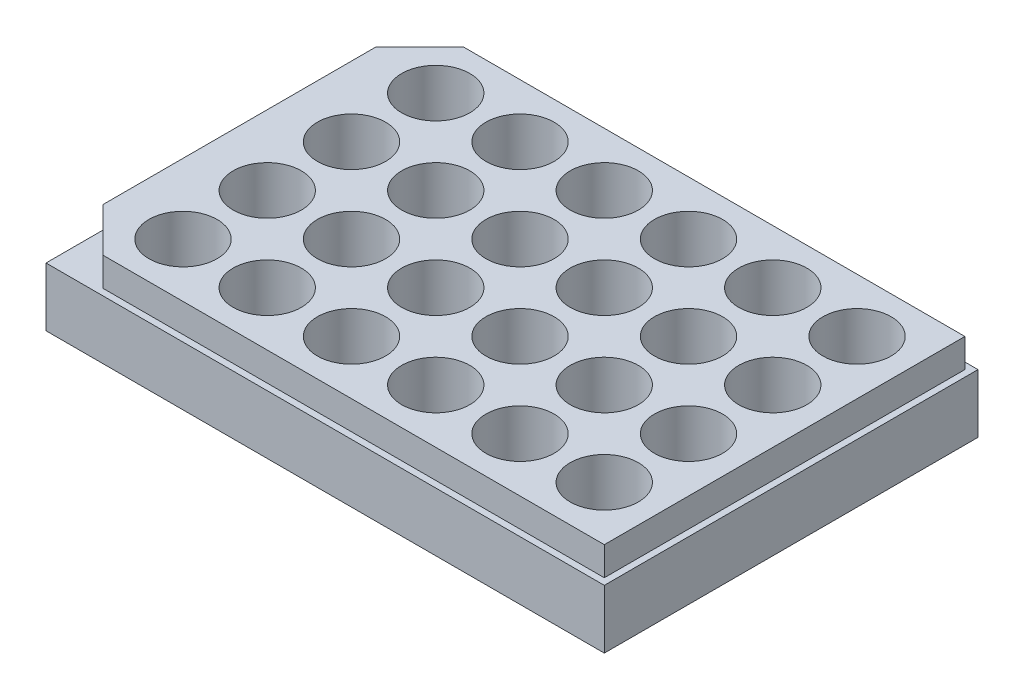
from build123d import *

# Parameters (mm, degrees)
SKETCH1_W         = 127.89
SKETCH1_H         = 85.6
MAIN_PLATE_DEPTH  = 20.02
WELLS_LSP_R       = 7.81
WELLS_DEPTH_DEPTH = 80.508511651
SKETCH7_W         = 127.89
SKETCH7_H         = 85.6
SKETCH7_W_2       = 124.89
SKETCH7_H_2       = 82.6
FLANGE_DEPTH      = 6.57
STYLE_3_DEPTH     = 6.57


with BuildPart() as part:
    # Sketch1 → Main Plate (new body)
    with BuildSketch(Plane(origin=(0, 0, 0), x_dir=(1, 0, 0), z_dir=(0, 1, 0))):
        Rectangle(SKETCH1_W, SKETCH1_H)
    extrude(amount=MAIN_PLATE_DEPTH)

    # Wells_LSP → Wells Depth (cut, through all)
    with BuildSketch(Plane(origin=(0, 20.02, 0), x_dir=(1, 0, 0), z_dir=(0, 1, 0))):
        with Locations(Location((-46.425, 28.96, 0), (0, 0, 270))):
            Circle(WELLS_LSP_R)
        with Locations(Location((-27.125, 28.96, 0), (0, 0, 270))):
            Circle(WELLS_LSP_R)
        with Locations(Location((-7.825, 28.96, 0), (0, 0, 270))):
            Circle(WELLS_LSP_R)
        with Locations(Location((11.475, 28.96, 0), (0, 0, 270))):
            Circle(WELLS_LSP_R)
        with Locations(Location((30.775, 28.96, 0), (0, 0, 270))):
            Circle(WELLS_LSP_R)
        with Locations(Location((50.075, 28.96, 0), (0, 0, 270))):
            Circle(WELLS_LSP_R)
        with Locations(Location((-27.125, 9.66, 0), (0, 0, 270))):
            Circle(WELLS_LSP_R)
        with Locations(Location((-7.825, 9.66, 0), (0, 0, 270))):
            Circle(WELLS_LSP_R)
        with Locations(Location((11.475, 9.66, 0), (0, 0, 270))):
            Circle(WELLS_LSP_R)
        with Locations(Location((30.775, 9.66, 0), (0, 0, 270))):
            Circle(WELLS_LSP_R)
        with Locations(Location((50.075, 9.66, 0), (0, 0, 270))):
            Circle(WELLS_LSP_R)
        with Locations(Location((-27.125, -9.64, 0), (0, 0, 270))):
            Circle(WELLS_LSP_R)
        with Locations(Location((-7.825, -9.64, 0), (0, 0, 270))):
            Circle(WELLS_LSP_R)
        with Locations(Location((11.475, -9.64, 0), (0, 0, 270))):
            Circle(WELLS_LSP_R)
        with Locations(Location((30.775, -9.64, 0), (0, 0, 270))):
            Circle(WELLS_LSP_R)
        with Locations(Location((50.075, -9.64, 0), (0, 0, 270))):
            Circle(WELLS_LSP_R)
        with Locations(Location((-27.125, -28.94, 0), (0, 0, 270))):
            Circle(WELLS_LSP_R)
        with Locations(Location((-7.825, -28.94, 0), (0, 0, 270))):
            Circle(WELLS_LSP_R)
        with Locations(Location((11.475, -28.94, 0), (0, 0, 270))):
            Circle(WELLS_LSP_R)
        with Locations(Location((30.775, -28.94, 0), (0, 0, 270))):
            Circle(WELLS_LSP_R)
        with Locations(Location((50.075, -28.94, 0), (0, 0, 270))):
            Circle(WELLS_LSP_R)
        with Locations(Location((-46.425, 9.66, 0), (0, 0, 270))):
            Circle(WELLS_LSP_R)
        with Locations(Location((-46.425, -9.64, 0), (0, 0, 270))):
            Circle(WELLS_LSP_R)
        with Locations(Location((-46.425, -28.94, 0), (0, 0, 270))):
            Circle(WELLS_LSP_R)
    extrude(amount=-WELLS_DEPTH_DEPTH, mode=Mode.SUBTRACT)

    # Sketch7 → Flange (cut)
    with BuildSketch(Plane(origin=(0, 20.02, 0), x_dir=(1, 0, 0), z_dir=(0, 1, 0))):
        Rectangle(SKETCH7_W, SKETCH7_H)
        Rectangle(SKETCH7_W_2, SKETCH7_H_2, mode=Mode.SUBTRACT)
    extrude(amount=-FLANGE_DEPTH, mode=Mode.SUBTRACT)

    # Style Sketch → Style <3 (cut)
    with BuildSketch(Plane(origin=(0, 20.02, 0), x_dir=(1, 0, 0), z_dir=(0, 1, 0))):
        Polygon((-62.445, 41.3), (-52.445, 41.3), (-62.445, 31.3), align=None)
        Polygon((-62.445, -41.3), (-52.445, -41.3), (-62.445, -31.3), align=None)
    extrude(amount=-STYLE_3_DEPTH, mode=Mode.SUBTRACT)


solid = part.part
